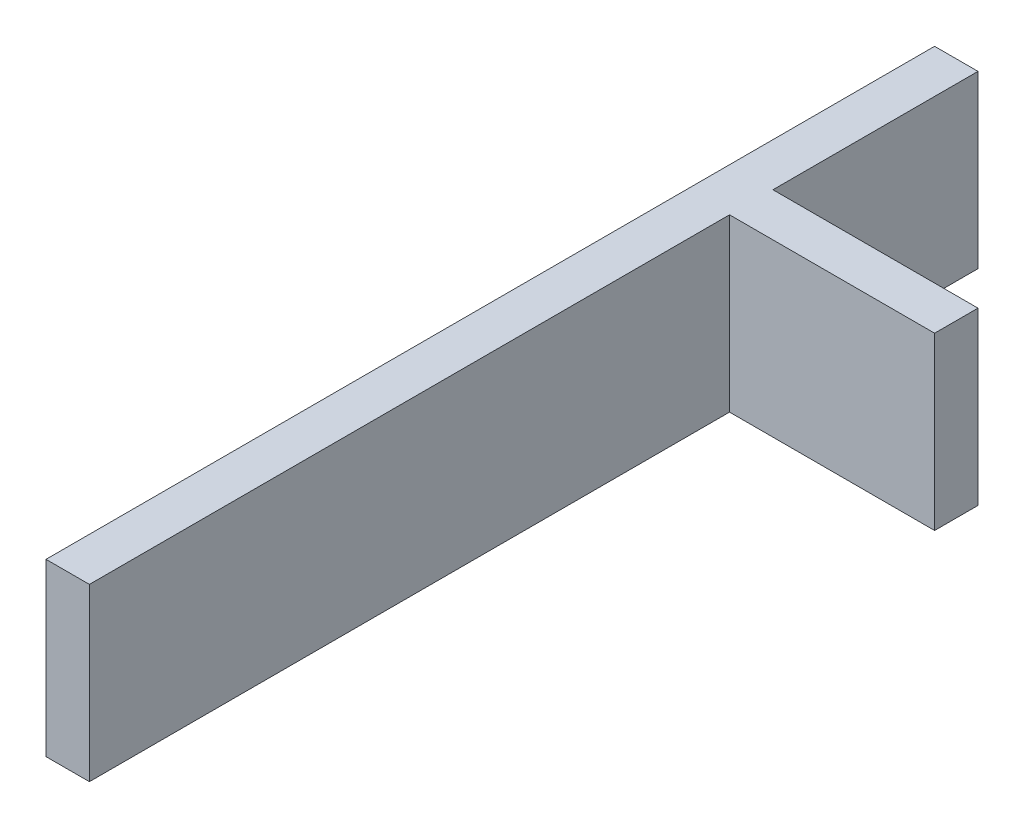
from build123d import *

# Parameters (mm, degrees)
CROQUIS1_W              = 6.35
CROQUIS1_H              = 25
SALIENTE_EXTRUIR1_DEPTH = 130
CROQUIS2_W              = 6.35
CROQUIS2_H              = 25
SALIENTE_EXTRUIR2_DEPTH = 30


with BuildPart() as part:
    # Croquis1 → Saliente-Extruir1 (new body)
    with BuildSketch(Plane.XY):
        Rectangle(CROQUIS1_W, CROQUIS1_H)
    extrude(amount=SALIENTE_EXTRUIR1_DEPTH)

    # Croquis2 → Saliente-Extruir2 (add)
    with BuildSketch(Plane(origin=(3.175, 0, 0), x_dir=(0, 0, -1), z_dir=(1, 0, 0))):
        with Locations((-33.175, 0)):
            Rectangle(CROQUIS2_W, CROQUIS2_H)
    extrude(amount=SALIENTE_EXTRUIR2_DEPTH)


solid = part.part
